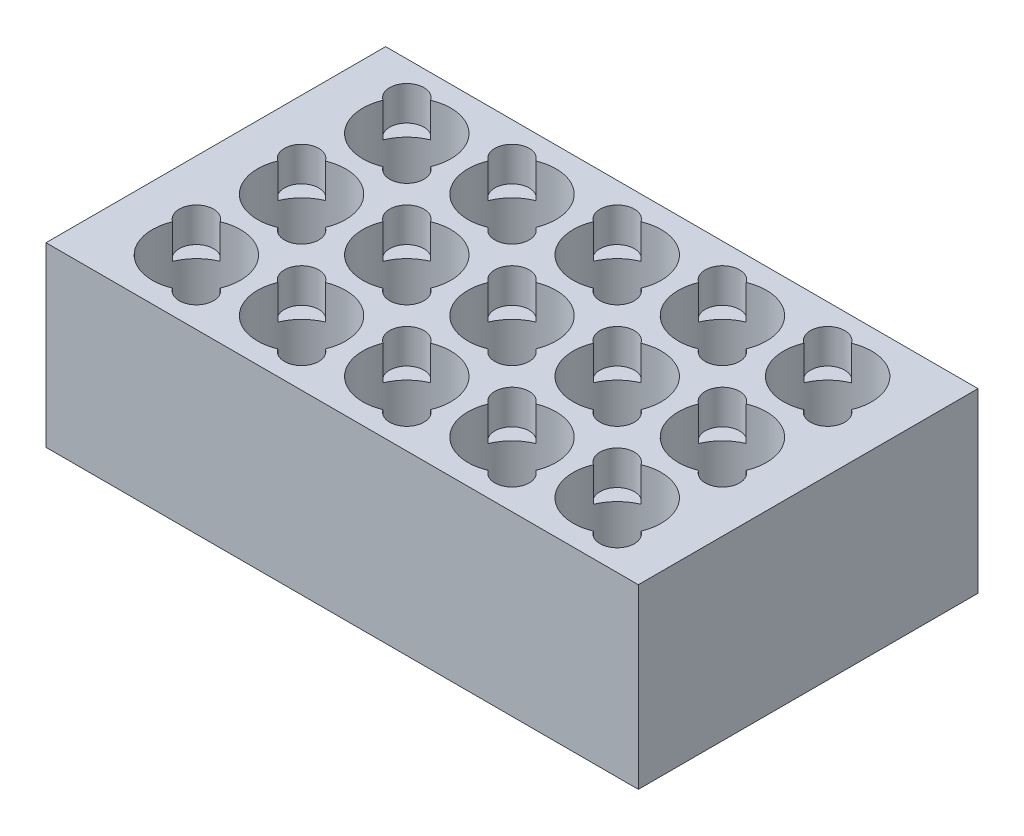
from build123d import *

# Parameters (mm, degrees)
SKETCH_532_W           = 518
SKETCH_532_H           = 297
EXTRUDE_604_DEPTH      = 155
SKETCH_5_3_R           = 38.5
CUT_EXTRUDE_11_DEPTH   = 123
SKETCH_1_R             = 15
CUT_EXTRUDE_1423_DEPTH = 30


with BuildPart() as part:
    # Sketch 532 → Extrude 604 (new body)
    with BuildSketch(Plane(origin=(0, 0, 0), x_dir=(1, 0, 0), z_dir=(0, 1, 0))):
        with Locations((184, -92)):
            Rectangle(SKETCH_532_W, SKETCH_532_H)
    extrude(amount=-EXTRUDE_604_DEPTH)

    # Матрица 5*3 → Ложемент для КМЕ-11 (cut)
    with BuildSketch(Plane(origin=(0, 0, 0), x_dir=(1, 0, 0), z_dir=(0, 1, 0))):
        with Locations(Location((0, 0, 0), (0, 0, 270))):
            Circle(SKETCH_5_3_R)
        with Locations(Location((92, 0, 0), (0, 0, 270))):
            Circle(SKETCH_5_3_R)
        with Locations(Location((184, 0, 0), (0, 0, 270))):
            Circle(SKETCH_5_3_R)
        with Locations(Location((276, 0, 0), (0, 0, 270))):
            Circle(SKETCH_5_3_R)
        with Locations(Location((368, 0, 0), (0, 0, 270))):
            Circle(SKETCH_5_3_R)
        with Locations(Location((0, -92, 0), (0, 0, 270))):
            Circle(SKETCH_5_3_R)
        with Locations(Location((92, -92, 0), (0, 0, 270))):
            Circle(SKETCH_5_3_R)
        with Locations(Location((184, -92, 0), (0, 0, 270))):
            Circle(SKETCH_5_3_R)
        with Locations(Location((276, -92, 0), (0, 0, 270))):
            Circle(SKETCH_5_3_R)
        with Locations(Location((368, -92, 0), (0, 0, 270))):
            Circle(SKETCH_5_3_R)
        with Locations(Location((0, -184, 0), (0, 0, 270))):
            Circle(SKETCH_5_3_R)
        with Locations(Location((92, -184, 0), (0, 0, 270))):
            Circle(SKETCH_5_3_R)
        with Locations(Location((184, -184, 0), (0, 0, 270))):
            Circle(SKETCH_5_3_R)
        with Locations(Location((276, -184, 0), (0, 0, 270))):
            Circle(SKETCH_5_3_R)
        with Locations(Location((368, -184, 0), (0, 0, 270))):
            Circle(SKETCH_5_3_R)
    extrude(amount=-CUT_EXTRUDE_11_DEPTH, mode=Mode.SUBTRACT)

    # Эскиз1 → Cut-Extrude 1423 (cut)
    with BuildSketch(Plane(origin=(0, 0, 0), x_dir=(1, 0, 0), z_dir=(0, 1, 0))):
        with Locations((27.223611076, -27.223611076)):
            Circle(SKETCH_1_R)
        with Locations((-27.223611076, 27.223611076)):
            Circle(SKETCH_1_R)
        with Locations((119.223611076, -27.223611076)):
            Circle(SKETCH_1_R)
        with Locations((64.776388924, 27.223611076)):
            Circle(SKETCH_1_R)
        with Locations((211.223611076, -27.223611076)):
            Circle(SKETCH_1_R)
        with Locations((156.776388924, 27.223611076)):
            Circle(SKETCH_1_R)
        with Locations((303.223611076, -27.223611076)):
            Circle(SKETCH_1_R)
        with Locations((248.776388924, 27.223611076)):
            Circle(SKETCH_1_R)
        with Locations((395.223611076, -27.223611076)):
            Circle(SKETCH_1_R)
        with Locations((340.776388924, 27.223611076)):
            Circle(SKETCH_1_R)
        with Locations((119.223611076, -119.223611076)):
            Circle(SKETCH_1_R)
        with Locations((64.776388924, -64.776388924)):
            Circle(SKETCH_1_R)
        with Locations((211.223611076, -119.223611076)):
            Circle(SKETCH_1_R)
        with Locations((156.776388924, -64.776388924)):
            Circle(SKETCH_1_R)
        with Locations((303.223611076, -119.223611076)):
            Circle(SKETCH_1_R)
        with Locations((248.776388924, -64.776388924)):
            Circle(SKETCH_1_R)
        with Locations((395.223611076, -119.223611076)):
            Circle(SKETCH_1_R)
        with Locations((340.776388924, -64.776388924)):
            Circle(SKETCH_1_R)
        with Locations((119.223611076, -211.223611076)):
            Circle(SKETCH_1_R)
        with Locations((64.776388924, -156.776388924)):
            Circle(SKETCH_1_R)
        with Locations((211.223611076, -211.223611076)):
            Circle(SKETCH_1_R)
        with Locations((156.776388924, -156.776388924)):
            Circle(SKETCH_1_R)
        with Locations((303.223611076, -211.223611076)):
            Circle(SKETCH_1_R)
        with Locations((248.776388924, -156.776388924)):
            Circle(SKETCH_1_R)
        with Locations((395.223611076, -211.223611076)):
            Circle(SKETCH_1_R)
        with Locations((340.776388924, -156.776388924)):
            Circle(SKETCH_1_R)
        with Locations((27.223611076, -119.223611076)):
            Circle(SKETCH_1_R)
        with Locations((-27.223611076, -64.776388924)):
            Circle(SKETCH_1_R)
        with Locations((27.223611076, -211.223611076)):
            Circle(SKETCH_1_R)
        with Locations((-27.223611076, -156.776388924)):
            Circle(SKETCH_1_R)
    extrude(amount=-CUT_EXTRUDE_1423_DEPTH, mode=Mode.SUBTRACT)


solid = part.part
